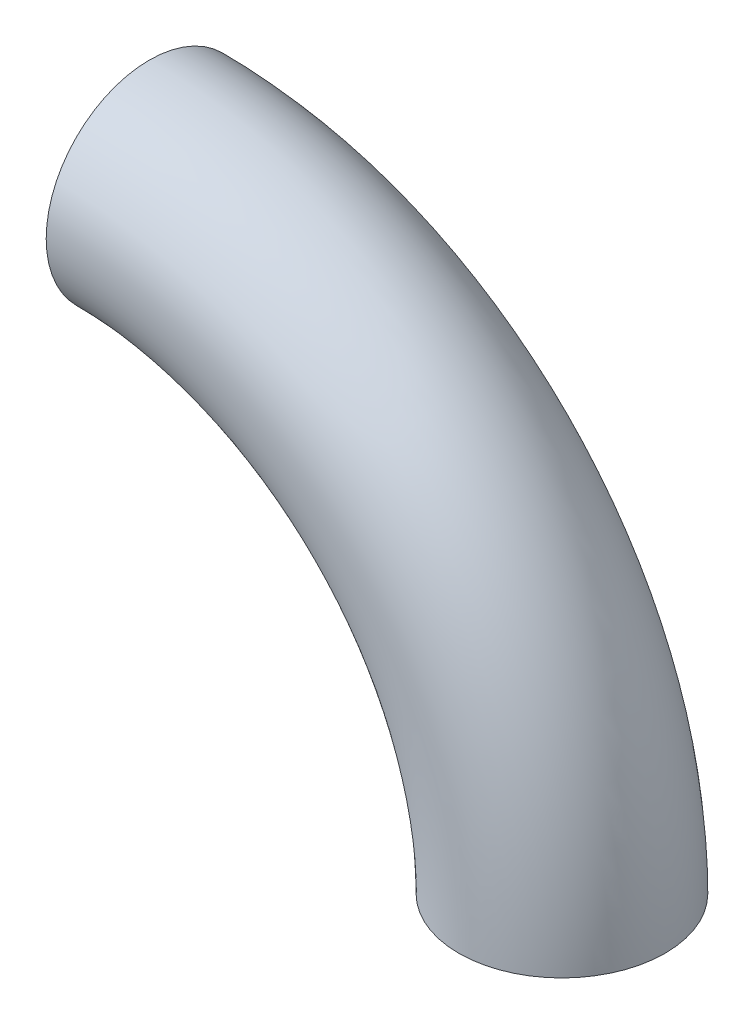
from build123d import *

# Parameters (mm, degrees)
SKETCH_MAIN_PROFILE_R = 5
FEATURE_TORUS_ANGLE   = 90


with BuildPart() as part:
    # sketch:main-profile → feature:torus (revolve)
    with BuildSketch(Plane.XZ):
        with Locations((20, 0)):
            Circle(SKETCH_MAIN_PROFILE_R)
    revolve(axis=Axis((0, 0, -15), (0, 0, 1)), revolution_arc=FEATURE_TORUS_ANGLE)


solid = part.part
